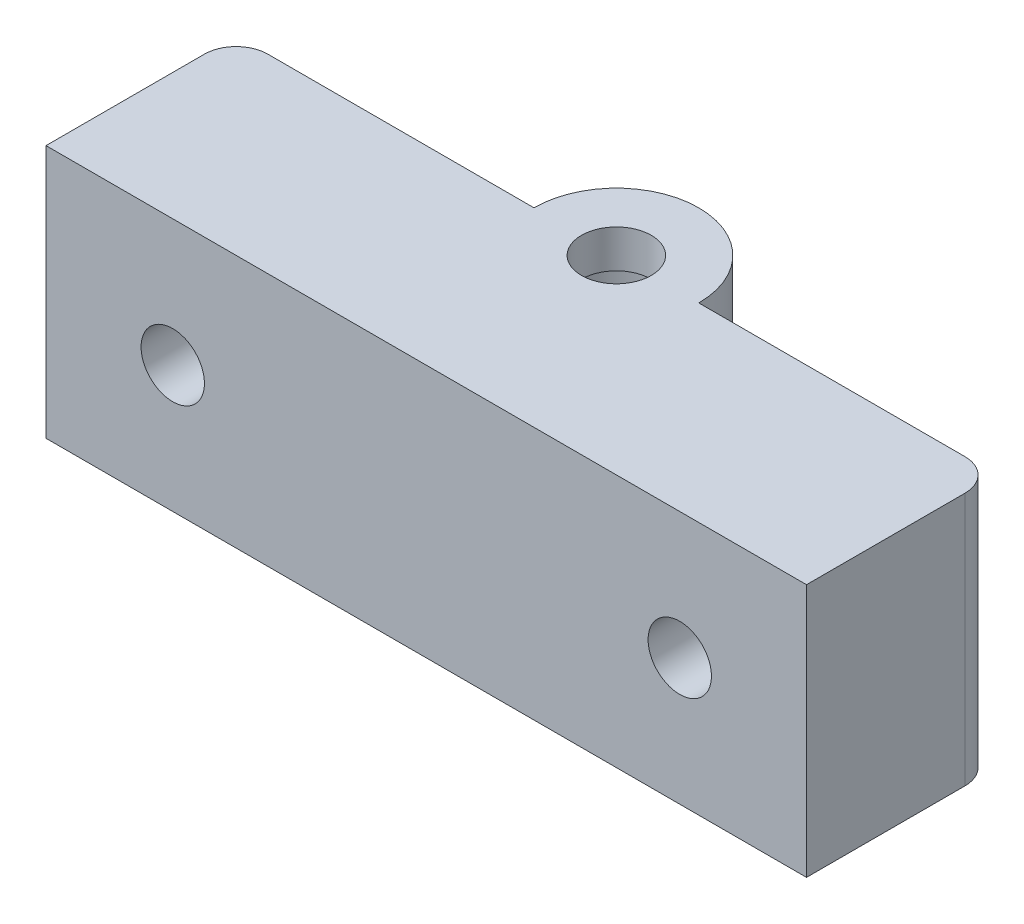
from build123d import *

# Parameters (mm, degrees)
ESQUISSE2_R             = 2.75
BOSS_EXTRU_1_DEPTH      = 20
ESQUISSE3_R             = 2.5
ENL_V_MAT_EXTRU_1_DEPTH = 20
ESQUISSE4_R             = 5
ESQUISSE4_R_2           = 2.75
ENL_V_MAT_EXTRU_2_DEPTH = 17


with BuildPart() as part:
    # Esquisse2 → Boss.-Extru.1 (new body)
    with BuildSketch(Plane(origin=(0, 0, 0), x_dir=(1, 0, 0), z_dir=(0, 1, 0))):
        with BuildLine():
            Line((-6.5, 0), (-27.5, 0))
            ThreePointArc((-27.5, 0), (-29.267766953, -0.732233047), (-30, -2.5))
            Line((-30, -2.5), (-30, -15))
            Line((-30, -15), (30, -15))
            Line((30, -15), (30, -2.5))
            ThreePointArc((30, -2.5), (29.267766953, -0.732233047), (27.5, 0))
            Line((27.5, 0), (6.5, 0))
            ThreePointArc((6.5, 0), (0, 6.5), (-6.5, 0))
        make_face()
        with Locations(Location((0, 0, 0), (0, 0, 270))):
            Circle(ESQUISSE2_R, mode=Mode.SUBTRACT)
    extrude(amount=BOSS_EXTRU_1_DEPTH)

    # Esquisse3 → Enlèv. mat.-Extru.1 (cut)
    with BuildSketch(Plane(origin=(0, 0, 0), x_dir=(-1, 0, 0), z_dir=(0, 0, -1))):
        with Locations((-20, 10)):
            Circle(ESQUISSE3_R)
        with Locations((20, 10)):
            Circle(ESQUISSE3_R)
    extrude(amount=-ENL_V_MAT_EXTRU_1_DEPTH, mode=Mode.SUBTRACT)

    # Esquisse4 → Enlèv. mat.-Extru.2 (cut)
    with BuildSketch(Plane.XZ):
        with Locations(Location((0, 0, 0), (0, 0, 270))):
            Circle(ESQUISSE4_R)
        with Locations(Location((0, 0, 0), (0, 0, 270))):
            Circle(ESQUISSE4_R_2, mode=Mode.SUBTRACT)
    extrude(amount=-ENL_V_MAT_EXTRU_2_DEPTH, mode=Mode.SUBTRACT)


solid = part.part
